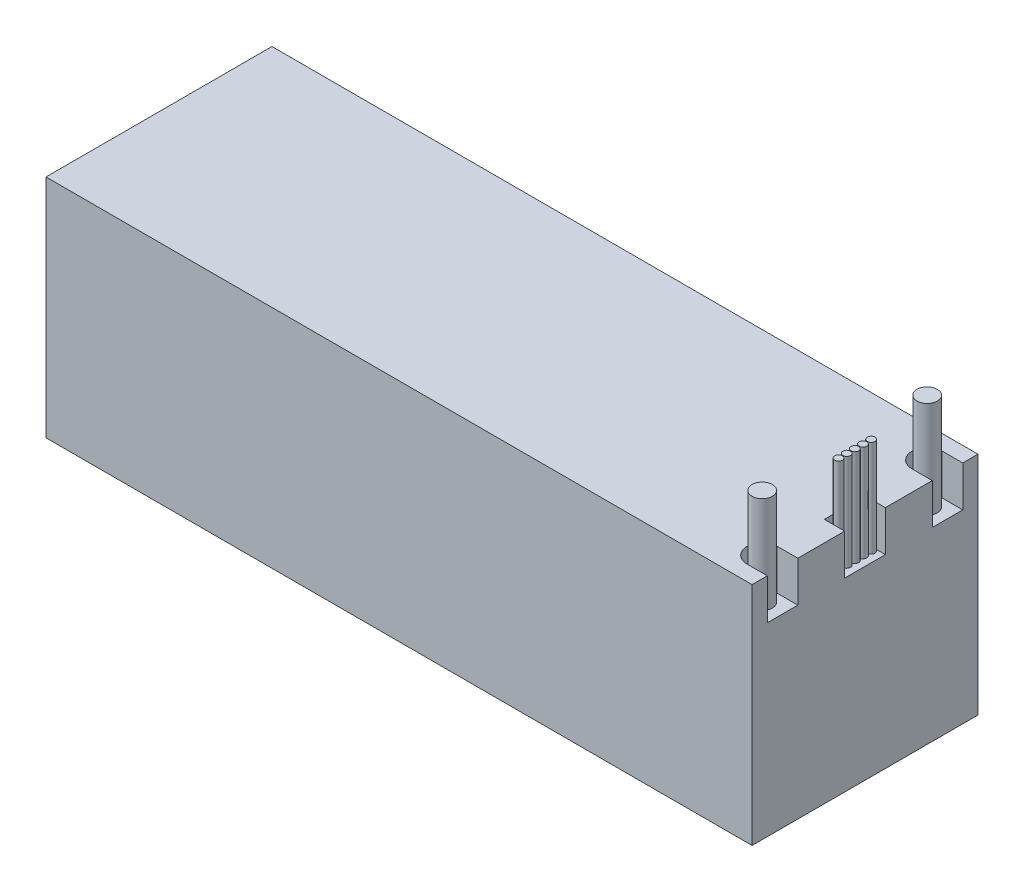
from build123d import *

# Parameters (mm, degrees)
SKETCH1_W           = 138.90625
SKETCH1_H           = 44.45
BOSS_EXTRUDE1_DEPTH = 44.45
SKETCH2_W           = 4
SKETCH2_H           = 8
CUT_EXTRUDE1_DEPTH  = 8
SKETCH3_R           = 2
SKETCH3_R_2         = 0.75
BOSS_EXTRUDE2_DEPTH = 19.05


with BuildPart() as part:
    # Sketch1 → Boss-Extrude1 (new body)
    with BuildSketch(Plane.XY):
        Rectangle(SKETCH1_W, SKETCH1_H)
    extrude(amount=BOSS_EXTRUDE1_DEPTH)

    # Sketch2 → Cut-Extrude1 (cut)
    with BuildSketch(Plane(origin=(0, 22.225, 0), x_dir=(1, 0, 0), z_dir=(0, 1, 0))):
        with BuildLine():
            Line((65.453125, -35.45), (69.453125, -35.45))
            Line((69.453125, -35.45), (69.453125, -41.45))
            Line((69.453125, -41.45), (65.453125, -41.45))
            ThreePointArc((65.453125, -41.45), (62.453125, -38.45), (65.453125, -35.45))
        make_face()
        with BuildLine():
            Line((69.453125, -3), (65.453125, -3))
            ThreePointArc((65.453125, -3), (62.453125, -6), (65.453125, -9))
            Line((65.453125, -9), (69.453125, -9))
            Line((69.453125, -9), (69.453125, -3))
        make_face()
        with Locations((67.453125, -22.225)):
            Rectangle(SKETCH2_W, SKETCH2_H)
    extrude(amount=-CUT_EXTRUDE1_DEPTH, mode=Mode.SUBTRACT)

    # Sketch3 → Boss-Extrude2 (add)
    with BuildSketch(Plane(origin=(0, 14.225, 0), x_dir=(1, 0, 0), z_dir=(0, 1, 0))):
        with Locations((65.453125, -38.45)):
            Circle(SKETCH3_R)
        with Locations((65.453125, -6)):
            Circle(SKETCH3_R)
        with Locations((67.453125, -19.0241)):
            Circle(SKETCH3_R_2)
        with Locations((67.453125, -20.6243)):
            Circle(SKETCH3_R_2)
        with Locations((67.453125, -22.2245)):
            Circle(SKETCH3_R_2)
        with Locations((67.453125, -23.8247)):
            Circle(SKETCH3_R_2)
        with Locations((67.453125, -25.4249)):
            Circle(SKETCH3_R_2)
    extrude(amount=BOSS_EXTRUDE2_DEPTH)


solid = part.part
